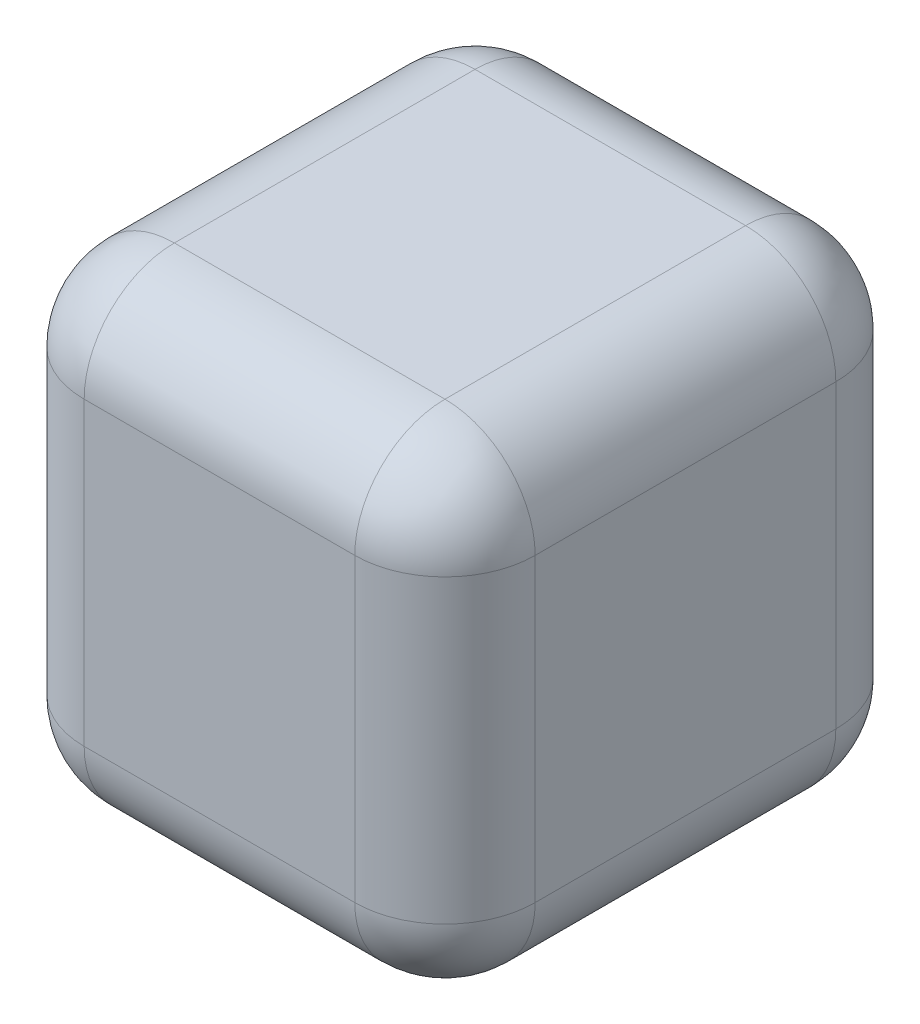
from build123d import *

# Parameters (mm, degrees)
SKETCH1_W           = 32
SKETCH1_H           = 32
BOSS_EXTRUDE1_DEPTH = 30
FILLET1_R           = 6
SKETCH2_R           = 0.8
CUT_EXTRUDE2_DEPTH  = 6


with BuildPart() as part:
    # Sketch1 → Boss-Extrude1 (new body)
    with BuildSketch(Plane(origin=(33.5, 0, 0), x_dir=(0, 0, -1), z_dir=(1, 0, 0))):
        Rectangle(SKETCH1_W, SKETCH1_H)
    extrude(amount=BOSS_EXTRUDE1_DEPTH)

    # Fillet1
    fillet1_edges = [part.edges().sort_by_distance(p)[0] for p in [
        (63.5, 0, -16),
        (63.5, 16, 0),
        (63.5, 0, 16),
        (33.5, 16, 0),
        (33.5, 0, -16),
        (33.5, -16, 0),
        (33.5, 0, 16),
        (48.5, 16, 16),
        (48.5, 16, -16),
        (48.5, -16, -16),
        (48.5, -16, 16),
        (63.5, -16, 0),
    ]]
    fillet(fillet1_edges, radius=FILLET1_R)

    # Sketch2 → Cut-Extrude2 (cut)
    with BuildSketch(Plane(origin=(33.5, 0, 0), x_dir=(0, 0, -1), z_dir=(1, 0, 0))):
        with Locations((-4.5, -4.5)):
            Circle(SKETCH2_R)
        with Locations((4.5, -4.5)):
            Circle(SKETCH2_R)
        with Locations((-4.5, 4.5)):
            Circle(SKETCH2_R)
        with Locations((4.5, 4.5)):
            Circle(SKETCH2_R)
    extrude(amount=CUT_EXTRUDE2_DEPTH, mode=Mode.SUBTRACT)


solid = part.part
